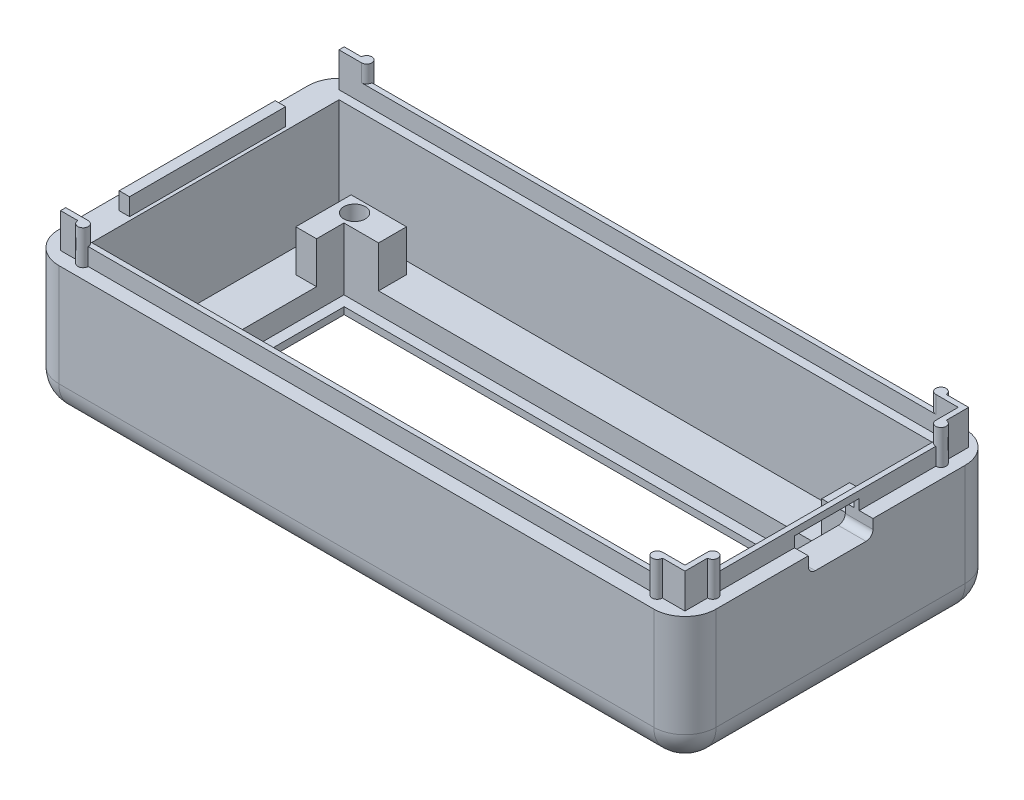
from build123d import *

# Parameters (mm, degrees)
SKETCH_1_W          = 95
SKETCH_1_H          = 45
EXTRUDE_1_DEPTH     = 19.3
SHELL_1_T           = -4
FILLET_1_R          = 4.5
SKETCH_2_W          = 71.05
SKETCH_2_H          = 22.55
CUT_EXTRUDE_1_DEPTH = 4.5
EXTRUDE_3_DEPTH     = 6
SKETCH_7_R          = 1.55
CUT_EXTRUDE_2_DEPTH = 4
EXTRUDE_5_DEPTH     = 5
EXTRUDE_6_DEPTH     = 2.5
SKETCH_9_W          = 1.5
SKETCH_9_H          = 22.55
EXTRUDE_7_DEPTH     = 2.5
SKETCH_10_W         = 74.05
SKETCH_10_H         = 26.962586992
CUT_EXTRUDE_3_DEPTH = 9
SKETCH_12_W         = 9.34
SKETCH_12_H         = 3.86
CUT_EXTRUDE_4_DEPTH = 24
FILLET_2_R          = 1
FILLET_3_R          = 1


with BuildPart() as part:
    # Эскиз1 → Бобышка-Вытянуть1 (new body)
    with BuildSketch(Plane(origin=(0, 0, 0), x_dir=(1, 0, 0), z_dir=(0, 1, 0))):
        with Locations((47.5, -22.5)):
            Rectangle(SKETCH_1_W, SKETCH_1_H)
    extrude(amount=EXTRUDE_1_DEPTH)

    # Оболочка1
    shell_1_openings = [part.faces().sort_by_distance(p)[0] for p in [
        (47.5, 19.3, 22.5),
    ]]
    offset(amount=SHELL_1_T, openings=shell_1_openings, kind=Kind.INTERSECTION)

    # Скругление1
    fillet_1_edges = [part.edges().sort_by_distance(p)[0] for p in [
        (47.5, 0, 45),
        (95, 0, 22.5),
        (47.5, 0, 0),
        (0, 0, 22.5),
        (95, 9.65, 0),
        (95, 9.65, 45),
        (0, 9.65, 0),
        (0, 9.65, 45),
    ]]
    fillet(fillet_1_edges, radius=FILLET_1_R)

    # Эскиз2 → Вырез-Вытянуть1 (cut)
    with BuildSketch(Plane(origin=(0, 0, 0), x_dir=(-1, 0, 0), z_dir=(0, -1, 0))):
        with Locations((-47.5, -22.5)):
            Rectangle(SKETCH_2_W, SKETCH_2_H)
    extrude(amount=-CUT_EXTRUDE_1_DEPTH, mode=Mode.SUBTRACT)

    # Эскиз6 → Бобышка-Вытянуть3 (add)
    with BuildSketch(Plane(origin=(0, 4, 0), x_dir=(1, 0, 0), z_dir=(0, 1, 0))):
        Polygon((11.975, -11.225), (11.975, -13.725), (7.475, -13.725), (7.475, -5.725), (15.475, -5.725), (15.475, -11.225), align=None)
        Polygon((11.975, -33.775), (11.975, -31.775), (7.475, -31.775), (7.475, -40.725), (15.475, -40.725), (15.475, -33.775), align=None)
        Polygon((87.525, -40.725), (79.525, -40.725), (79.525, -33.775), (83.025, -33.775), (83.025, -31.775), (87.525, -31.775), align=None)
        Polygon((79.525, -5.725), (79.525, -11.225), (83.025, -11.225), (83.025, -13.725), (87.525, -13.725), (87.525, -5.725), align=None)
    extrude(amount=EXTRUDE_3_DEPTH)

    # Эскиз7 → Вырез-Вытянуть2 (cut)
    with BuildSketch(Plane(origin=(0, 10, 0), x_dir=(1, 0, 0), z_dir=(0, 1, 0))):
        with Locations((9.975, -7.725)):
            Circle(SKETCH_7_R)
        with Locations((85.025, -7.725)):
            Circle(SKETCH_7_R)
        with Locations((9.975, -38.725)):
            Circle(SKETCH_7_R)
        with Locations((85.025, -38.725)):
            Circle(SKETCH_7_R)
    extrude(amount=-CUT_EXTRUDE_2_DEPTH, mode=Mode.SUBTRACT)

    # Эскиз8 → Бобышка-Вытянуть5 (add)
    with BuildSketch(Plane(origin=(0, 19.3, 0), x_dir=(1, 0, 0), z_dir=(0, 1, 0))):
        with BuildLine():
            Line((5.25, -2), (2.75, -2))
            Line((2.75, -2), (2.75, -2.75))
            Line((2.75, -2.75), (6, -2.75))
            ThreePointArc((6, -2.75), (6.530330086, -1.469669914), (5.25, -2))
        make_face()
        with BuildLine():
            Line((6, -42.25), (2.75, -42.25))
            Line((2.75, -42.25), (2.75, -43))
            Line((2.75, -43), (5.25, -43))
            ThreePointArc((5.25, -43), (6.530330086, -43.530330086), (6, -42.25))
        make_face()
        with BuildLine():
            Line((93, -2), (89.75, -2))
            ThreePointArc((89.75, -2), (88.469669914, -1.469669914), (89, -2.75))
            Line((89, -2.75), (92.25, -2.75))
            Line((92.25, -2.75), (92.25, -6))
            ThreePointArc((92.25, -6), (93.530330086, -6.530330086), (93, -5.25))
            Line((93, -5.25), (93, -2))
        make_face()
        with BuildLine():
            Line((92.25, -42.25), (89, -42.25))
            ThreePointArc((89, -42.25), (88.469669914, -43.530330086), (89.75, -43))
            Line((89.75, -43), (93, -43))
            Line((93, -43), (93, -39.75))
            ThreePointArc((93, -39.75), (93.530330086, -38.469669914), (92.25, -39))
            Line((92.25, -39), (92.25, -42.25))
        make_face()
    extrude(amount=EXTRUDE_5_DEPTH)

    # Эскиз8<4> → Бобышка-Вытянуть6 (add)
    with BuildSketch(Plane(origin=(0, 19.3, 0), x_dir=(1, 0, 0), z_dir=(0, 1, 0))):
        with BuildLine():
            ThreePointArc((6.75, -2), (6.530330086, -2.530330086), (6, -2.75))
            Line((6, -2.75), (89, -2.75))
            ThreePointArc((89, -2.75), (88.469669914, -2.530330086), (88.25, -2))
            Line((88.25, -2), (6.75, -2))
        make_face()
        with BuildLine():
            Line((89, -42.25), (6, -42.25))
            ThreePointArc((6, -42.25), (6.530330086, -42.469669914), (6.75, -43))
            Line((6.75, -43), (88.25, -43))
            ThreePointArc((88.25, -43), (88.469669914, -42.469669914), (89, -42.25))
        make_face()
        with BuildLine():
            ThreePointArc((93, -6.75), (92.469669914, -6.530330086), (92.25, -6))
            Line((92.25, -6), (92.25, -39))
            ThreePointArc((92.25, -39), (92.469669914, -38.469669914), (93, -38.25))
            Line((93, -38.25), (93, -6.75))
        make_face()
    extrude(amount=EXTRUDE_6_DEPTH)

    # Эскиз9 → Бобышка-Вытянуть7 (add)
    with BuildSketch(Plane(origin=(0, 19.3, 0), x_dir=(1, 0, 0), z_dir=(0, 1, 0))):
        with Locations((2.75, -22.5)):
            Rectangle(SKETCH_9_W, SKETCH_9_H)
    extrude(amount=EXTRUDE_7_DEPTH)

    # Эскиз10 → Вырез-Вытянуть3 (cut)
    with BuildSketch(Plane(origin=(0, 10, 0), x_dir=(1, 0, 0), z_dir=(0, 1, 0))):
        with Locations((47.5, -23.243706504)):
            Rectangle(SKETCH_10_W, SKETCH_10_H)
    extrude(amount=-CUT_EXTRUDE_3_DEPTH, mode=Mode.SUBTRACT)

    # Эскиз12 → Вырез-Вытянуть4 (cut)
    with BuildSketch(Plane(origin=(95, 0, 0), x_dir=(0, 0, -1), z_dir=(1, 0, 0))):
        with Locations((-22.5, 18.87)):
            Rectangle(SKETCH_12_W, SKETCH_12_H)
    extrude(amount=-CUT_EXTRUDE_4_DEPTH, mode=Mode.SUBTRACT)

    # Скругление2
    fillet_2_edges = [part.edges().sort_by_distance(p)[0] for p in [
        (93, 16.94, 27.17),
    ]]
    fillet(fillet_2_edges, radius=FILLET_2_R)

    # Скругление3
    fillet_3_edges = [part.edges().sort_by_distance(p)[0] for p in [
        (93, 16.94, 17.83),
    ]]
    fillet(fillet_3_edges, radius=FILLET_3_R)


solid = part.part
